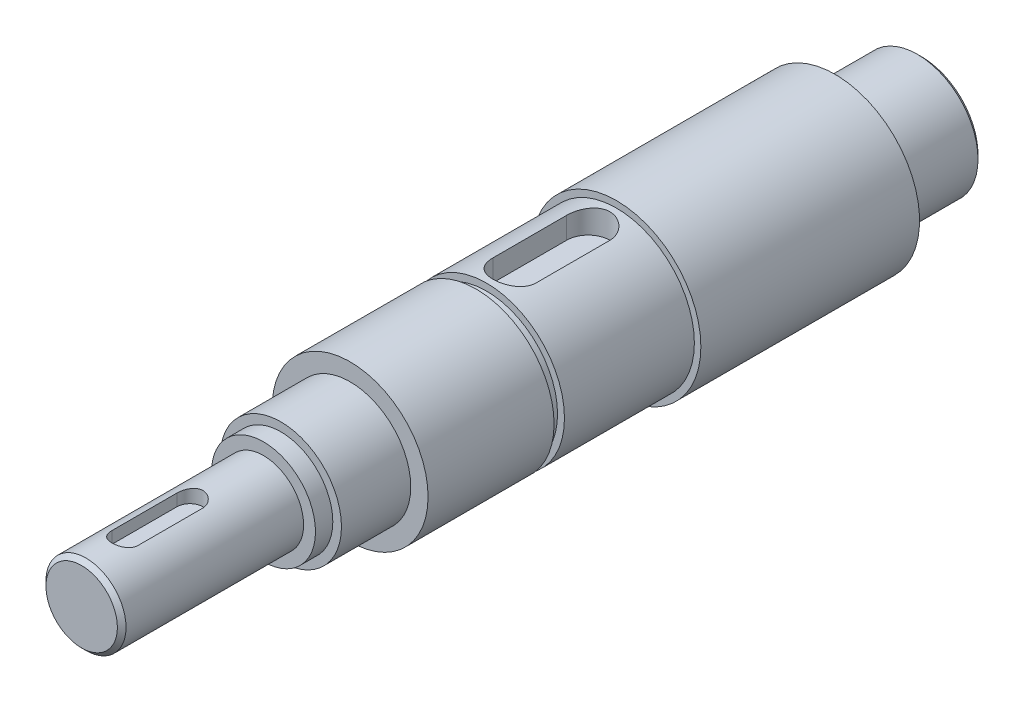
from build123d import *

# Parameters (mm, degrees)
BOSS_EXTRUDE1_DEPTH      = 5
BOSS_EXTRUDE1_DEPTH_BACK = 34
SKETCH1_R                = 18
SKETCH2_R                = 14
BOSS_EXTRUDE2_DEPTH      = 50
BOSS_EXTRUDE3_START      = 80
SKETCH3_R                = 14
BOSS_EXTRUDE3_DEPTH      = 80
CUT_EXTRUDE2_DEPTH       = 9
SKETCH6_R                = 19.5
SKETCH6_R_2              = 18
BOSS_EXTRUDE4_DEPTH      = 4
SKETCH10_R               = 19.5
SKETCH10_R_2             = 18
BOSS_EXTRUDE6_DEPTH      = 1.5
SKETCH12_W               = 2.4
SKETCH12_H               = 5.371583629
SKETCH13_R               = 18
BOSS_EXTRUDE7_DEPTH      = 2
SKETCH14_W               = 5.5
SKETCH14_H               = 45
SKETCH17_R               = 14.891727411
CUT_EXTRUDE4_DEPTH       = 18
BOSS_EXTRUDE8_START      = 3
SKETCH18_R               = 14
BOSS_EXTRUDE8_DEPTH      = 3
SKETCH19_R               = 18
BOSS_EXTRUDE9_DEPTH      = 26
SKETCH20_R               = 17.17468577
SKETCH20_R_2             = 9.25
CUT_EXTRUDE5_DEPTH       = 6
BOSS_EXTRUDE10_START     = 40
SKETCH21_R               = 9.25
BOSS_EXTRUDE10_DEPTH     = 40
SKETCH22_R               = 12
BOSS_EXTRUDE11_DEPTH     = 4
CHAMFER1_SIZE            = 1
CUT_EXTRUDE6_DEPTH       = 10


with BuildPart() as part:
    # Sketch1 → Boss-Extrude1 (new, two sides: drawn at the far end of the back side and taken through both)
    with BuildSketch(Plane.XY.offset(-BOSS_EXTRUDE1_DEPTH_BACK)):
        Circle(SKETCH1_R)
    extrude(amount=BOSS_EXTRUDE1_DEPTH + BOSS_EXTRUDE1_DEPTH_BACK)

    # Sketch2 → Boss-Extrude2 (add)
    with BuildSketch(Plane.XY.offset(5)):
        Circle(SKETCH2_R)
    extrude(amount=BOSS_EXTRUDE2_DEPTH)

    # Sketch3 → Boss-Extrude3 (add)
    with BuildSketch(Plane(origin=(0, 0, -34), x_dir=(-1, 0, 0), z_dir=(0, 0, -1)).offset(BOSS_EXTRUDE3_START)):
        with Locations(Location((0, 0, 0), (0, 0, 180))):
            Circle(SKETCH3_R)
    extrude(amount=-BOSS_EXTRUDE3_DEPTH)

    # Sketch5 → Cut-Extrude2 (cut)
    with BuildSketch(Plane.XZ.offset(-21.3)):
        with BuildLine():
            Line((-5, -5), (-5, -22))
            ThreePointArc((-5, -22), (0, -27), (5, -22))
            Line((5, -22), (5, -5))
            ThreePointArc((5, -5), (0, 0), (-5, -5))
        make_face()
    extrude(amount=CUT_EXTRUDE2_DEPTH, mode=Mode.SUBTRACT)

    # Sketch6 → Boss-Extrude4 (add)
    with BuildSketch(Plane(origin=(0, 0, -34), x_dir=(-1, 0, 0), z_dir=(0, 0, -1))):
        Circle(SKETCH6_R)
        with Locations(Location((0, 0, 0), (0, 0, 270))):
            Circle(SKETCH6_R_2, mode=Mode.SUBTRACT)
    extrude(amount=-BOSS_EXTRUDE4_DEPTH)

    # Sketch10 → Boss-Extrude6 (add)
    with BuildSketch(Plane.XY.offset(-30)):
        with Locations(Location((0, 0, 0), (0, 0, 180))):
            Circle(SKETCH10_R)
        Circle(SKETCH10_R_2, mode=Mode.SUBTRACT)
    extrude(amount=BOSS_EXTRUDE6_DEPTH)

    # Sketch12 → Cut-Revolve1 (revolve, cut)
    with BuildSketch(Plane(origin=(0, 0, 0), x_dir=(0, 0, -1), z_dir=(1, 0, 0)), mode=Mode.PRIVATE) as cut_revolve1_sk:
        with Locations((-2.7, 19.085791815)):
            Rectangle(SKETCH12_W, SKETCH12_H)
    revolve(cut_revolve1_sk.sketch.rotate(Axis((0, 0, 1.5), (0, 0, -1)), 90), axis=Axis((0, 0, 1.5), (0, 0, -1)), mode=Mode.SUBTRACT)

    # Sketch13 → Boss-Extrude7 (add)
    with BuildSketch(Plane.XY.offset(5)):
        Circle(SKETCH13_R)
    extrude(amount=BOSS_EXTRUDE7_DEPTH)

    # Sketch14 → Revolve1 (revolve)
    with BuildSketch(Plane(origin=(0, 0, 0), x_dir=(1, 0, 0), z_dir=(0, 1, 0)), mode=Mode.PRIVATE) as revolve1_sk:
        with Locations((16.75, 56.5)):
            Rectangle(SKETCH14_W, SKETCH14_H)
    revolve(revolve1_sk.sketch.rotate(Axis((0, 0, -114), (0, 0, 1)), 180), axis=Axis((0, 0, -114), (0, 0, 1)))

    # Sketch17 → Cut-Extrude4 (cut)
    with BuildSketch(Plane(origin=(0, 0, -114), x_dir=(-1, 0, 0), z_dir=(0, 0, -1))):
        Circle(SKETCH17_R)
    extrude(amount=-CUT_EXTRUDE4_DEPTH, mode=Mode.SUBTRACT)

    # Sketch18 → Boss-Extrude8 (add)
    with BuildSketch(Plane(origin=(0, 0, -96), x_dir=(-1, 0, 0), z_dir=(0, 0, -1)).offset(BOSS_EXTRUDE8_START)):
        with Locations(Location((0, 0, 0), (0, 0, 180))):
            Circle(SKETCH18_R)
    extrude(amount=-BOSS_EXTRUDE8_DEPTH)

    # Sketch19 → Boss-Extrude9 (add)
    with BuildSketch(Plane.XY.offset(7)):
        Circle(SKETCH19_R)
    extrude(amount=BOSS_EXTRUDE9_DEPTH)

    # Sketch20 → Cut-Extrude5 (cut)
    with BuildSketch(Plane.XY.offset(55)):
        Circle(SKETCH20_R)
        Circle(SKETCH20_R_2, mode=Mode.SUBTRACT)
    extrude(amount=-CUT_EXTRUDE5_DEPTH, mode=Mode.SUBTRACT)

    # Sketch21 → Boss-Extrude10 (add)
    with BuildSketch(Plane.XY.offset(55).offset(BOSS_EXTRUDE10_START)):
        Circle(SKETCH21_R)
    extrude(amount=-BOSS_EXTRUDE10_DEPTH)

    # Sketch22 → Boss-Extrude11 (add)
    with BuildSketch(Plane.XY.offset(49)):
        Circle(SKETCH22_R)
    extrude(amount=BOSS_EXTRUDE11_DEPTH)

    # Chamfer1
    chamfer1_edges = [part.edges().sort_by_distance(p)[0] for p in [
        (-14, 0, -99),
        (-9.25, 0, 95),
    ]]
    chamfer(chamfer1_edges, length=CHAMFER1_SIZE)

    # Sketch24 → Cut-Extrude6 (cut)
    with BuildSketch(Plane(origin=(0, 6, 0), x_dir=(1, 0, 0), z_dir=(0, 1, 0))):
        with BuildLine():
            Line((3, -70), (3, -85))
            ThreePointArc((3, -85), (0, -88), (-3, -85))
            Line((-3, -85), (-3, -70))
            ThreePointArc((-3, -70), (0, -67), (3, -70))
        make_face()
    extrude(amount=CUT_EXTRUDE6_DEPTH, mode=Mode.SUBTRACT)


solid = part.part
